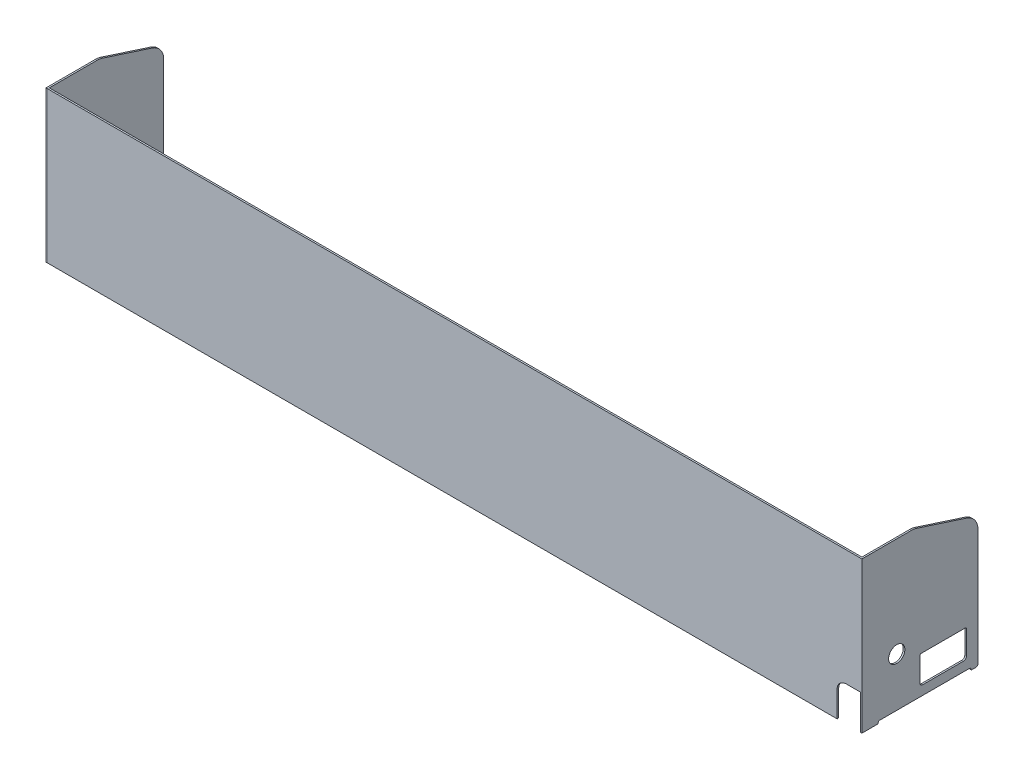
from build123d import *

# Parameters (mm, degrees)
BACK_WALL_DEPTH  = 0.7
SKETCH2_R        = 3.5
RIGHT_WALL_DEPTH = 0.7


with BuildPart() as part:
    # Sketch1 → Back Wall (new body)
    with BuildSketch(Plane.XY):
        with BuildLine():
            Line((175, -17.5), (169, -17.5))
            ThreePointArc((169, -17.5), (166.171572875, -18.671572875), (165, -21.5))
            Line((165, -21.5), (165, -32.5))
            Line((165, -32.5), (-175, -32.5))
            Line((-175, -32.5), (-175, 32.5))
            Line((-175, 32.5), (175, 32.5))
            Line((175, 32.5), (175, -17.5))
        make_face()
    extrude(amount=BACK_WALL_DEPTH)


with BuildPart() as body_2:
    # Sketch2 → Right Wall (new body)
    with BuildSketch(Plane.ZY.offset(175)):
        with BuildLine():
            Line((-48.3, -32.5), (-46.5, -32.5))
            ThreePointArc((-46.5, -32.5), (-46.358578644, -32.441421356), (-46.3, -32.3))
            Line((-46.3, -32.3), (-46.3, -32.2))
            ThreePointArc((-46.3, -32.2), (-46.094974747, -31.705025253), (-45.6, -31.5))
            Line((-45.6, -31.5), (-7, -31.5))
            ThreePointArc((-7, -31.5), (-6.505025253, -31.705025253), (-6.3, -32.2))
            Line((-6.3, -32.2), (-6.3, -32.3))
            ThreePointArc((-6.3, -32.3), (-6.241421356, -32.441421356), (-6.1, -32.5))
            Line((-6.1, -32.5), (0.7, -32.5))
            Line((0.7, -32.5), (0.7, 32.5))
            Line((0.7, 32.5), (-20.643340495, 32.5))
            ThreePointArc((-20.643340495, 32.5), (-21.733083601, 32.414655448), (-22.79625424, 32.160702846))
            Line((-22.79625424, 32.160702846), (-44.452913745, 25.160702846))
            ThreePointArc((-44.452913745, 25.160702846), (-47.959964497, 22.618835016), (-49.3, 18.5))
            Line((-49.3, 18.5), (-49.3, -31.5))
            ThreePointArc((-49.3, -31.5), (-49.007106781, -32.207106781), (-48.3, -32.5))
        make_face()
        with Locations(Location((-14.3, -10.5, 0), (0, 0, 270))):
            Circle(SKETCH2_R, mode=Mode.SUBTRACT)
        with BuildLine():
            Line((-43.8, -15.5), (-24.8, -15.5))
            ThreePointArc((-24.8, -15.5), (-24.446446609, -15.646446609), (-24.3, -16))
            Line((-24.3, -16), (-24.3, -26.3))
            ThreePointArc((-24.3, -26.3), (-24.651471863, -27.148528137), (-25.5, -27.5))
            Line((-25.5, -27.5), (-43.1, -27.5))
            ThreePointArc((-43.1, -27.5), (-43.948528137, -27.148528137), (-44.3, -26.3))
            Line((-44.3, -26.3), (-44.3, -16))
            ThreePointArc((-44.3, -16), (-44.153553391, -15.646446609), (-43.8, -15.5))
        make_face(mode=Mode.SUBTRACT)
    right_wall = extrude(amount=RIGHT_WALL_DEPTH)


with BuildPart() as part_1:
    add(part.part)

    # Mirror8: Right Wall across plane
    add(right_wall.mirror(Plane(origin=(0, 0, 0), x_dir=(0, 0, 1), z_dir=(1, 0, 0))))


solid = Compound([body_2.part, part_1.part])
